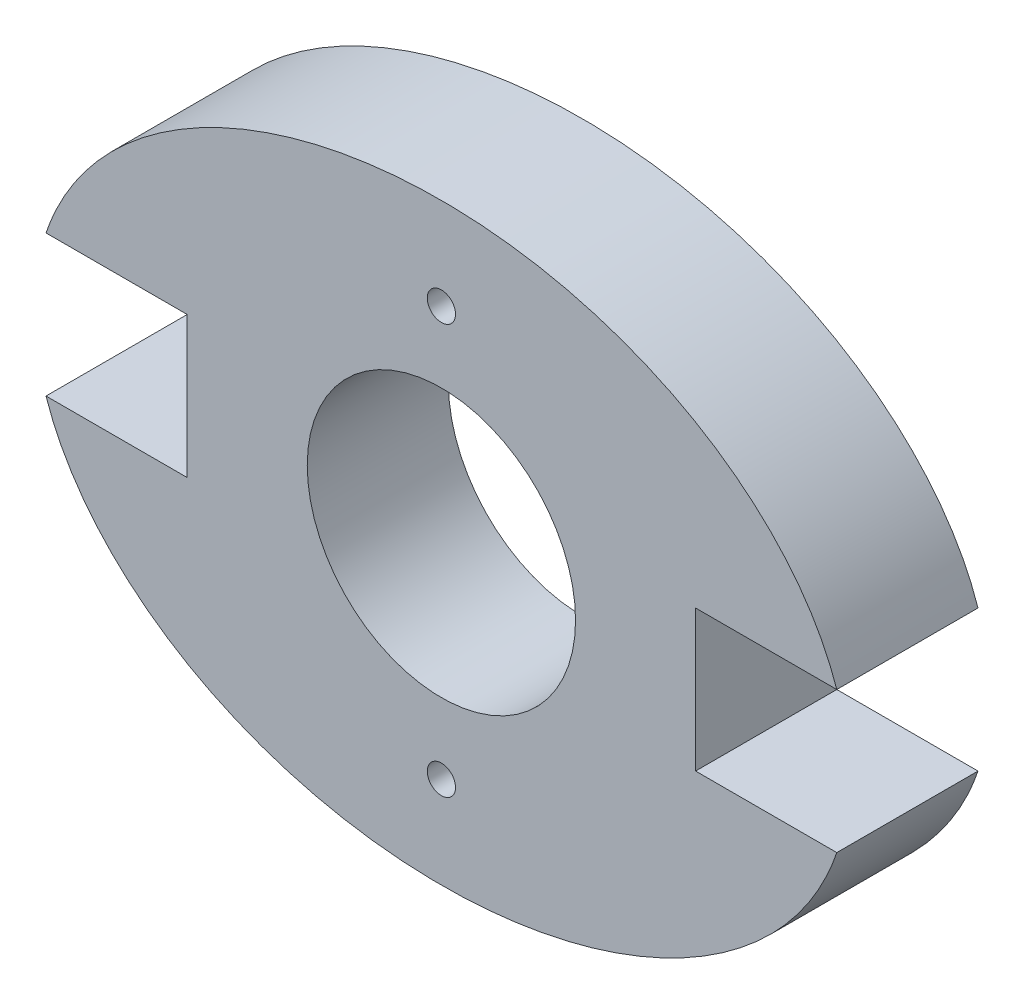
from build123d import *

# Parameters (mm, degrees)
ESQUISSE1_R        = 0.5
ESQUISSE1_R_2      = 4.75
BOSS_EXTRU_1_DEPTH = 5


with BuildPart() as part:
    # Esquisse1 → Boss.-Extru.1 (new body)
    with BuildSketch(Plane.XY):
        with BuildLine():
            Line((-14, 2.5), (-9, 2.5))
            Line((-9, 2.5), (-9, -2.5))
            Line((-9, -2.5), (-14, -2.5))
            add(Edge.make_bspline(
                [(-14, -2.5), (-11.307692308, -10.5), (0, -10.5), (11.307692308, -10.5), (14, -2.5)],
                knots=[3.38199687, 3.38199687, 3.38199687, 4.71238898, 4.71238898, 6.04278109, 6.04278109, 6.04278109], degree=2, weights=[1, 0.786795792, 1, 0.786795792, 1]))
            Line((14, -2.5), (9, -2.5))
            Line((9, -2.5), (9, 2.5))
            Line((9, 2.5), (14, 2.5))
            add(Edge.make_bspline(
                [(14, 2.5), (11.307692308, 10.5), (0, 10.5), (-11.307692308, 10.5), (-14, 2.5)],
                knots=[0.240404217, 0.240404217, 0.240404217, 1.570796327, 1.570796327, 2.901188437, 2.901188437, 2.901188437], degree=2, weights=[1, 0.786795792, 1, 0.786795792, 1]))
        make_face()
        with Locations((0, 7.2545)):
            Circle(ESQUISSE1_R, mode=Mode.SUBTRACT)
        with Locations((0, -7.2545)):
            Circle(ESQUISSE1_R, mode=Mode.SUBTRACT)
        Circle(ESQUISSE1_R_2, mode=Mode.SUBTRACT)
    extrude(amount=BOSS_EXTRU_1_DEPTH)


solid = part.part
